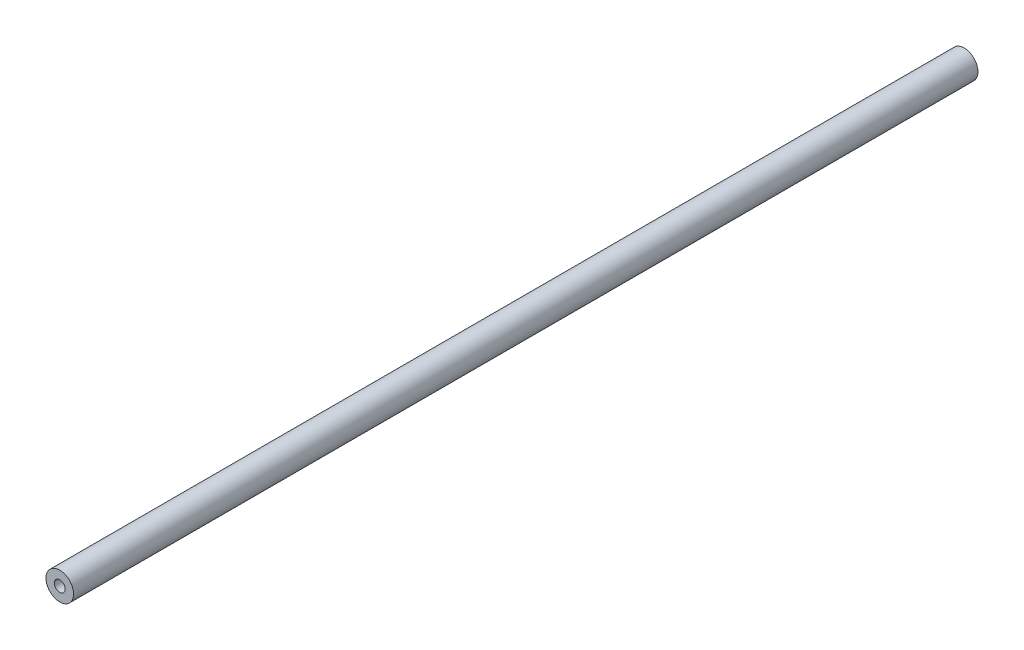
from build123d import *

# Parameters (mm, degrees)
SKETCH1_R             = 6.35
BOSS_EXTRUDE2_DEPTH   = 416.433
M6X1_0_TAPPED_HOLE1_D = 5


with BuildPart() as part:
    # Sketch1 → Boss-Extrude2 (new body)
    with BuildSketch(Plane.XY):
        Circle(SKETCH1_R)
    extrude(amount=BOSS_EXTRUDE2_DEPTH)

    # M6x1.0 Tapped Hole1 (through all)
    with Locations(Plane.XY.offset(416.433)):
        with Locations((0, 0)):
            Hole(M6X1_0_TAPPED_HOLE1_D / 2)


solid = part.part
